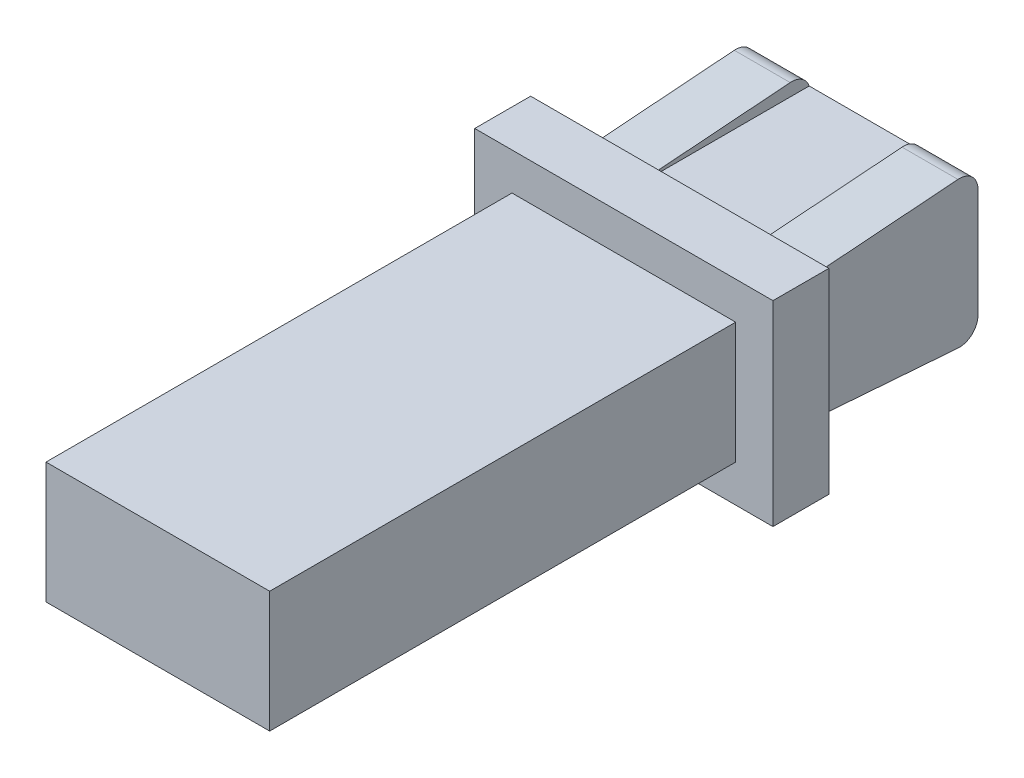
from build123d import *

# Parameters (mm, degrees)
SKETCH1_W           = 12
SKETCH1_H           = 6.5
BOSS_EXTRUDE1_DEPTH = 10
SKETCH2_W           = 16
SKETCH2_H           = 10.5
BOSS_EXTRUDE2_DEPTH = 3
SKETCH3_W           = 12
SKETCH3_H           = 6.5
BOSS_EXTRUDE3_DEPTH = 25
BOSS_EXTRUDE4_DEPTH = 12
FILLET1_R           = 1
CUT_EXTRUDE1_REACH  = 41.186
SKETCH5_W           = 6
SKETCH5_H           = 0.672191444


with BuildPart() as part:
    # Sketch1 → Boss-Extrude1 (new body)
    with BuildSketch(Plane.XY):
        Rectangle(SKETCH1_W, SKETCH1_H)
    extrude(amount=BOSS_EXTRUDE1_DEPTH)

    # Sketch2 → Boss-Extrude2 (add)
    with BuildSketch(Plane.XY.offset(10)):
        Rectangle(SKETCH2_W, SKETCH2_H)
    extrude(amount=BOSS_EXTRUDE2_DEPTH)

    # Sketch3 → Boss-Extrude3 (add)
    with BuildSketch(Plane.XY.offset(13)):
        Rectangle(SKETCH3_W, SKETCH3_H)
    extrude(amount=BOSS_EXTRUDE3_DEPTH)

    # Sketch4 → Boss-Extrude4 (add)
    with BuildSketch(Plane(origin=(6, 0, 0), x_dir=(0, 0, -1), z_dir=(1, 0, 0))):
        Polygon((-10, 3.25), (0, 4), (0, 3.25), align=None)
        Polygon((-10, -3.25), (0, -4), (0, -3.25), align=None)
    extrude(amount=-BOSS_EXTRUDE4_DEPTH)

    # Fillet1
    fillet1_edges = [part.edges().sort_by_distance(p)[0] for p in [
        (0, -4, 0),
        (0, 4, 0),
    ]]
    fillet(fillet1_edges, radius=FILLET1_R)

    # Sketch5 → Cut-Extrude1 (cut, up to next)
    with BuildSketch(Plane(origin=(0, 0, 0), x_dir=(-1, 0, 0), z_dir=(0, 0, -1)), mode=Mode.PRIVATE) as cut_extrude1_sk1:
        with Locations((0, 3.586095722)):
            Rectangle(SKETCH5_W, SKETCH5_H)
    cut_extrude1_tool1 = extrude(cut_extrude1_sk1.sketch, amount=-CUT_EXTRUDE1_REACH, mode=Mode.PRIVATE) & part.part
    # Sketch5 → Cut-Extrude1 (cut, up to next)
    with BuildSketch(Plane(origin=(0, 0, 0), x_dir=(-1, 0, 0), z_dir=(0, 0, -1)), mode=Mode.PRIVATE) as cut_extrude1_sk2:
        with Locations((0, -3.586095722)):
            Rectangle(SKETCH5_W, SKETCH5_H)
    cut_extrude1_tool2 = extrude(cut_extrude1_sk2.sketch, amount=-CUT_EXTRUDE1_REACH, mode=Mode.PRIVATE) & part.part
    add(cut_extrude1_tool1.solids().sort_by_distance((0, 3.586096, 0))[0], mode=Mode.SUBTRACT)
    add(cut_extrude1_tool2.solids().sort_by_distance((0, -3.586096, 0))[0], mode=Mode.SUBTRACT)


solid = part.part
